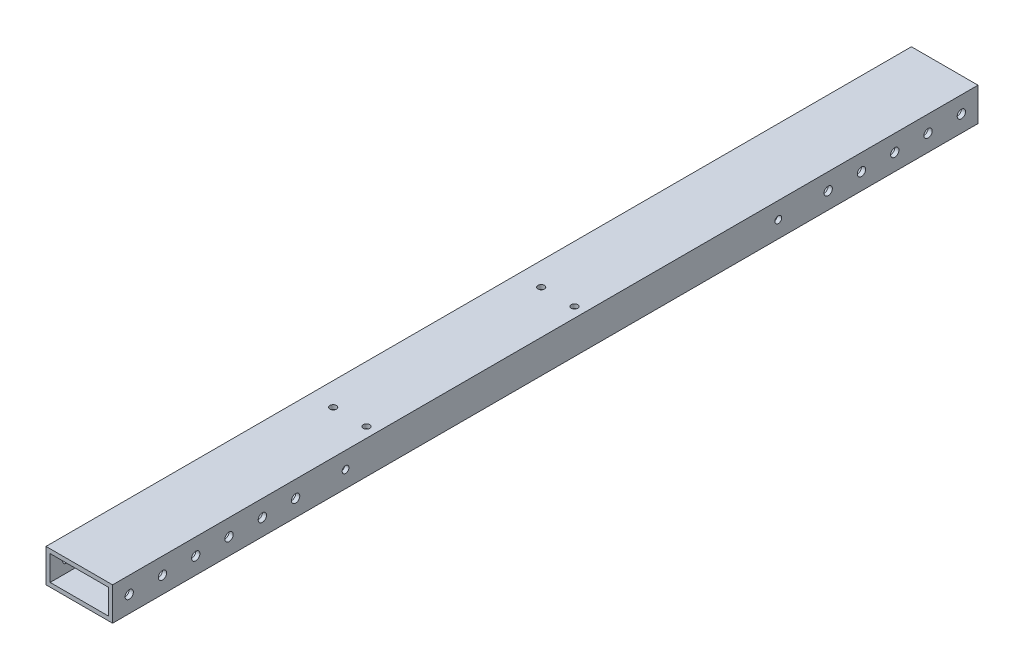
from build123d import *

# Parameters (mm, degrees)
BOSS_EXTRUDE1_DEPTH              = 330.2
BOSS_EXTRUDE1_DEPTH_BACK         = 330.2
SKETCH3_W                        = 50.8
SKETCH3_H                        = 25.4
SKETCH3_W_2                      = 44.45
SKETCH3_H_2                      = 19.05
F_1_4_0_25_DIAMETER_HOLE3_D      = 6.35
F_1_4_0_25_DIAMETER_HOLE4_D      = 6.35
F_1_4_0_25_DIAMETER_HOLE5_D      = 6.35
F_1_4_0_25_DIAMETER_HOLE6_D      = 6.35
F_1_4_0_25_DIAMETER_HOLE7_D      = 6.35
F_1_4_0_25_DIAMETER_HOLE8_D      = 6.35
F_13_64_0_20313_DIAMETER_HOLE1_D = 5.159502
F_1_2_0_5_DIAMETER_HOLE1_D       = 12.7
F_1_2_0_5_DIAMETER_HOLE1_DEPTH   = 6.35
F_1_2_0_5_DIAMETER_HOLE1_TIP     = 3.815464931
F_10_CLEARANCE_HOLE1_D           = 4.9784
F_10_CLEARANCE_HOLE1_DEPTH       = 25.4
F_10_CLEARANCE_HOLE1_TIP         = 1.495662253


with BuildPart() as part:
    # Sketch3 → Boss-Extrude1 (new, two sides: drawn at the far end of the back side and taken through both)
    with BuildSketch(Plane.XY.offset(-BOSS_EXTRUDE1_DEPTH_BACK)):
        Rectangle(SKETCH3_W, SKETCH3_H)
        Rectangle(SKETCH3_W_2, SKETCH3_H_2, mode=Mode.SUBTRACT)
    extrude(amount=BOSS_EXTRUDE1_DEPTH + BOSS_EXTRUDE1_DEPTH_BACK)

    # 1/4 (0.25) Diameter Hole3 (through all)
    with Locations(Plane.ZY.offset(25.4)):
        with Locations((-317.5, 0)):
            Hole(F_1_4_0_25_DIAMETER_HOLE3_D / 2)

    # 1/4 (0.25) Diameter Hole4 (through all)
    with Locations(Plane.ZY.offset(25.4)):
        with Locations((292.1, 0), (317.5, 0)):
            Hole(F_1_4_0_25_DIAMETER_HOLE4_D / 2)

    # 1/4 (0.25) Diameter Hole5 (through all)
    with Locations(Plane(origin=(25.4, 0, 0), x_dir=(0, 0, -1), z_dir=(1, 0, 0))):
        with Locations((292.1, 0), (266.7, 0)):
            Hole(F_1_4_0_25_DIAMETER_HOLE5_D / 2)

    # 1/4 (0.25) Diameter Hole6 (through all)
    with Locations(Plane(origin=(25.4, 0, 0), x_dir=(0, 0, -1), z_dir=(1, 0, 0))):
        with Locations((215.9, 0), (241.3, 0)):
            Hole(F_1_4_0_25_DIAMETER_HOLE6_D / 2)

    # 1/4 (0.25) Diameter Hole7 (through all)
    with Locations(Plane(origin=(25.4, 0, 0), x_dir=(0, 0, -1), z_dir=(1, 0, 0))):
        with Locations((-190.5, 0), (-215.9, 0)):
            Hole(F_1_4_0_25_DIAMETER_HOLE7_D / 2)

    # 1/4 (0.25) Diameter Hole8 (through all)
    with Locations(Plane(origin=(25.4, 0, 0), x_dir=(0, 0, -1), z_dir=(1, 0, 0))):
        with Locations((-266.7, 0), (-241.3, 0)):
            Hole(F_1_4_0_25_DIAMETER_HOLE8_D / 2)

    # 13/64 (0.20313) Diameter Hole1 (through all)
    with Locations(Plane(origin=(25.4, 0, 0), x_dir=(0, 0, -1), z_dir=(1, 0, 0))):
        with Locations((-152.4, 0), (177.8, 0)):
            Hole(F_13_64_0_20313_DIAMETER_HOLE1_D / 2)

    # 1/2 (0.5) Diameter Hole1
    with Locations(Plane.ZY.offset(25.4)):
        with Locations((-146.050000508, 4.9e-08), (120.65, 1.7e-08)):
            Hole(F_1_2_0_5_DIAMETER_HOLE1_D / 2, depth=F_1_2_0_5_DIAMETER_HOLE1_DEPTH)
            with Locations((0, 0, -(F_1_2_0_5_DIAMETER_HOLE1_DEPTH + F_1_2_0_5_DIAMETER_HOLE1_TIP / 2))):  # 118° drill point
                Cone(0, F_1_2_0_5_DIAMETER_HOLE1_D / 2, F_1_2_0_5_DIAMETER_HOLE1_TIP, mode=Mode.SUBTRACT)

    # #10 Clearance Hole1
    with Locations(Plane(origin=(0, -12.7, 0), x_dir=(-1, 0, 0), z_dir=(0, -1, 0))):
        with Locations((7.747762, 30.0312328), (-17.652238, 30.0312328), (-17.652238, -128.7187672), (7.747762, -128.7187672)):
            Hole(F_10_CLEARANCE_HOLE1_D / 2, depth=F_10_CLEARANCE_HOLE1_DEPTH)
            with Locations((0, 0, -(F_10_CLEARANCE_HOLE1_DEPTH + F_10_CLEARANCE_HOLE1_TIP / 2))):  # 118° drill point
                Cone(0, F_10_CLEARANCE_HOLE1_D / 2, F_10_CLEARANCE_HOLE1_TIP, mode=Mode.SUBTRACT)


solid = part.part
